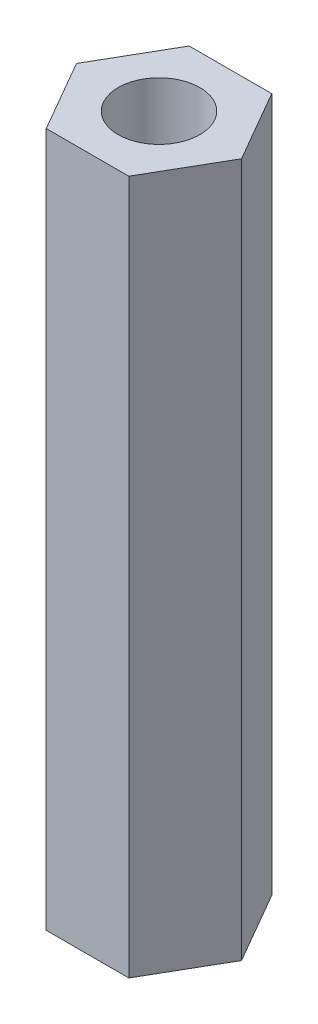
from build123d import *

# Parameters (mm, degrees)
SKETCH1_R           = 2
BOSS_EXTRUDE1_DEPTH = 34


with BuildPart() as part:
    # Sketch1 → Boss-Extrude1 (new body)
    with BuildSketch(Plane(origin=(0, 0, 0), x_dir=(1, 0, 0), z_dir=(0, 1, 0))):
        Polygon((2.020725942, 3.5), (-2.020725942, 3.5), (-4.041451884, 0), (-2.020725942, -3.5), (2.020725942, -3.5), (4.041451884, 0), align=None)
        with Locations(Location((0, 0, 0), (0, 0, 270))):
            Circle(SKETCH1_R, mode=Mode.SUBTRACT)
    extrude(amount=BOSS_EXTRUDE1_DEPTH)


solid = part.part
